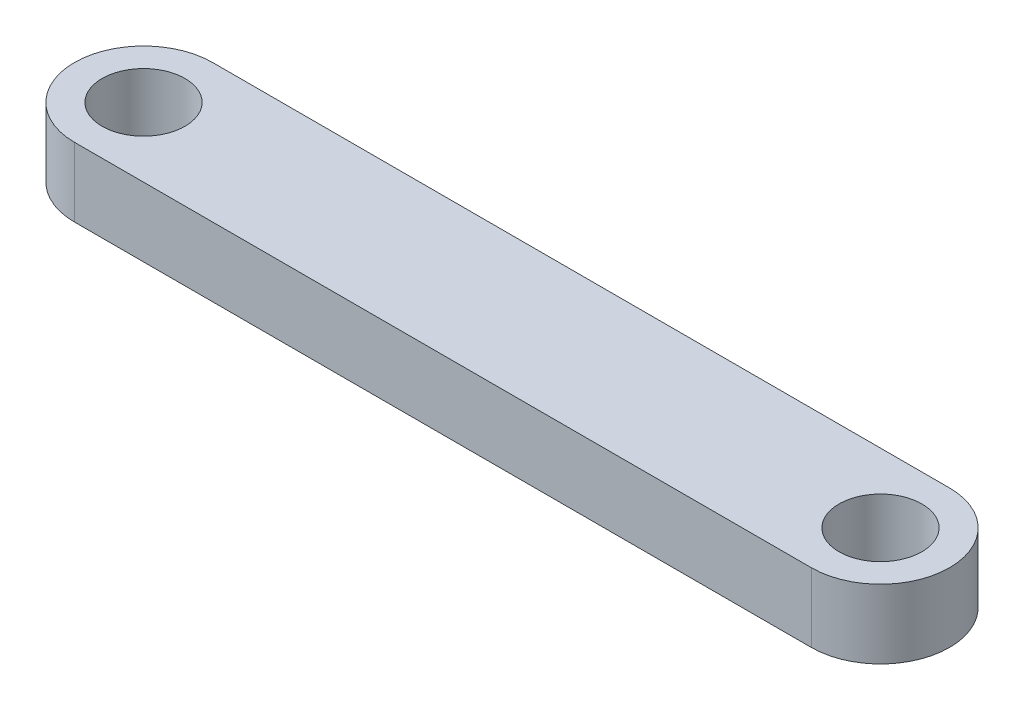
from build123d import *

# Parameters (mm, degrees)
SKETCH1_R           = 1.8
BOSS_EXTRUDE1_DEPTH = 3


with BuildPart() as part:
    # Sketch1 → Boss-Extrude1 (new body)
    with BuildSketch(Plane(origin=(0, 0, 0), x_dir=(1, 0, 0), z_dir=(0, 1, 0))):
        with BuildLine():
            Line((0, -3), (-32, -3))
            ThreePointArc((-32, -3), (-35, 0), (-32, 3))
            Line((-32, 3), (0, 3))
            ThreePointArc((0, 3), (3, 0), (0, -3))
        make_face()
        with Locations(Location((-32, 0, 0), (0, 0, 270))):
            Circle(SKETCH1_R, mode=Mode.SUBTRACT)
        with Locations(Location((0, 0, 0), (0, 0, 270))):
            Circle(SKETCH1_R, mode=Mode.SUBTRACT)
    extrude(amount=BOSS_EXTRUDE1_DEPTH)


solid = part.part
